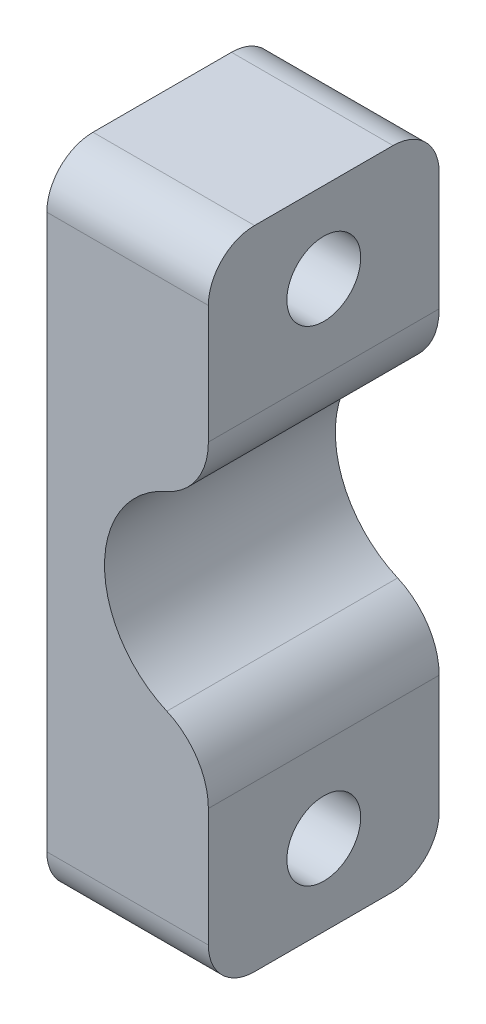
from build123d import *

# Parameters (mm, degrees)
SKETCH1_W               = 12
SKETCH1_H               = 2.1
BOSS_EXTRUDE1_DEPTH     = 3
BOSS_EXTRUDE1_2_DEPTH   = 3
SKETCH2_W               = 4
SKETCH2_H               = 6
BOSS_EXTRUDE2_DEPTH     = 6
SKETCH3_W               = 7
SKETCH3_H               = 28
BOSS_EXTRUDE3_DEPTH     = 5
CUT_EXTRUDE1_DEPTH      = 25.108425983
CUT_EXTRUDE1_DEPTH_BACK = 25.108425983
SKETCH5_R               = 4.5
FILLET1_R               = 3
FILLET2_R               = 2
SKETCH6_R               = 1.6
CUT_EXTRUDE2_DEPTH      = 16
SKETCH7_W               = 18.107499601
SKETCH7_H               = 21.771661969
CUT_EXTRUDE3_DEPTH      = 30


with BuildPart() as part:
    # Sketch1 → Boss-Extrude1 (new, symmetric)
    with BuildSketch(Plane.XY):
        with Locations((0, 1.95)):
            Rectangle(SKETCH1_W, SKETCH1_H)
    extrude(amount=BOSS_EXTRUDE1_DEPTH, both=True)


with BuildPart() as body_2:
    # Sketch1 → Boss-Extrude1 2 (new, symmetric)
    with BuildSketch(Plane.XY):
        with Locations((0, -1.95)):
            Rectangle(SKETCH1_W, SKETCH1_H)
    extrude(amount=BOSS_EXTRUDE1_2_DEPTH, both=True)


with BuildPart() as body_3:
    # Sketch2 → Boss-Extrude2 (new body)
    with BuildSketch(Plane.XY.offset(3)):
        with Locations((8, 0)):
            Rectangle(SKETCH2_W, SKETCH2_H)
    extrude(amount=-BOSS_EXTRUDE2_DEPTH)

    # Sketch3 → Boss-Extrude3 (add, symmetric)
    with BuildSketch(Plane.XY):
        with Locations((13.388345193, 0)):
            Rectangle(SKETCH3_W, SKETCH3_H)
    extrude(amount=BOSS_EXTRUDE3_DEPTH, both=True)

    # Sketch5 → Cut-Extrude1 (cut, two sides: drawn at the far end of the back side and taken through both)
    with BuildSketch(Plane.XY.offset(5).offset(-CUT_EXTRUDE1_DEPTH_BACK)):
        with Locations((16.888345193, 0)):
            Circle(SKETCH5_R)
    extrude(amount=CUT_EXTRUDE1_DEPTH + CUT_EXTRUDE1_DEPTH_BACK, mode=Mode.SUBTRACT)

    # Fillet1
    fillet1_edges = [body_3.edges().sort_by_distance(p)[0] for p in [
        (9.888345193, -3, 0),
        (9.888345193, 3, 0),
        (16.888345193, -4.5, 0),
        (16.888345193, 4.5, 0),
    ]]
    fillet(fillet1_edges, radius=FILLET1_R)

    # Fillet2
    fillet2_edges = [body_3.edges().sort_by_distance(p)[0] for p in [
        (13.388345193, -14, -5),
        (13.388345193, 14, -5),
        (13.388345193, -14, 5),
        (13.388345193, 14, 5),
    ]]
    fillet(fillet2_edges, radius=FILLET2_R)

    # Sketch6 → Cut-Extrude2 (cut)
    with BuildSketch(Plane(origin=(16.888345193, 0, 0), x_dir=(0, 0, -1), z_dir=(1, 0, 0))):
        with Locations((0, 10.5)):
            Circle(SKETCH6_R)
        with Locations((0, -10.5)):
            Circle(SKETCH6_R)
    extrude(amount=-CUT_EXTRUDE2_DEPTH, mode=Mode.SUBTRACT)


with BuildPart() as cut_extrude3_tool:
    # Sketch7 → Cut-Extrude3 (new body)
    with BuildSketch(Plane.XY.offset(5)):
        with Locations((0.834595393, 1.114169015)):
            Rectangle(SKETCH7_W, SKETCH7_H)
    extrude(amount=-CUT_EXTRUDE3_DEPTH)


with BuildPart() as part_1:
    add(part.part)

    # Cut-Extrude3: cut by cut_extrude3_tool
    add(cut_extrude3_tool.part, mode=Mode.SUBTRACT)


with BuildPart() as body_2_1:
    add(body_2.part)

    # Cut-Extrude3: cut by cut_extrude3_tool
    add(cut_extrude3_tool.part, mode=Mode.SUBTRACT)


with BuildPart() as body_3_1:
    add(body_3.part)

    # Cut-Extrude3: cut by cut_extrude3_tool
    add(cut_extrude3_tool.part, mode=Mode.SUBTRACT)


solid = body_3_1.part
